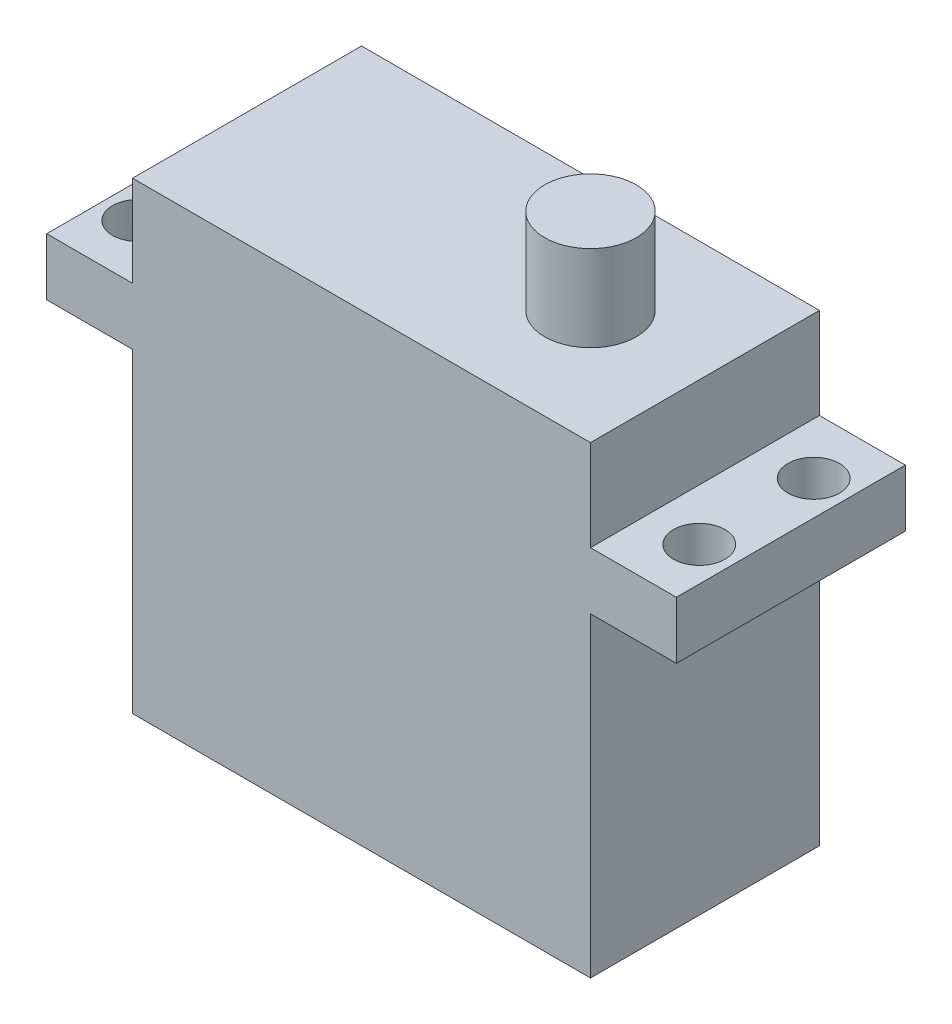
from build123d import *

# Parameters (mm, degrees)
SKETCH1_W           = 40
SKETCH1_H           = 20
BOSS_EXTRUDE1_DEPTH = 40.5
SKETCH2_W           = 20
SKETCH2_H           = 5
BOSS_EXTRUDE2_DEPTH = 7.5
SKETCH3_R           = 2.25
CUT_EXTRUDE1_DEPTH  = 50.964987741
SKETCH4_R           = 4
BOSS_EXTRUDE3_DEPTH = 7.5


with BuildPart() as part:
    # Sketch1 → Boss-Extrude1 (new body)
    with BuildSketch(Plane(origin=(0, 0, 0), x_dir=(1, 0, 0), z_dir=(0, 1, 0))):
        Rectangle(SKETCH1_W, SKETCH1_H)
    extrude(amount=BOSS_EXTRUDE1_DEPTH)

    # Sketch2 → Boss-Extrude2 (add)
    with BuildSketch(Plane(origin=(20, 0, 0), x_dir=(0, 0, -1), z_dir=(1, 0, 0))):
        with Locations((0, 30.05)):
            Rectangle(SKETCH2_W, SKETCH2_H)
    boss_extrude2 = extrude(amount=BOSS_EXTRUDE2_DEPTH)

    # Mirror1: Boss-Extrude2 across plane
    add(boss_extrude2.mirror(Plane(origin=(0, 0, 0), x_dir=(0, 0, 1), z_dir=(1, 0, 0))))

    # Sketch3 → Cut-Extrude1 (cut, through all)
    with BuildSketch(Plane(origin=(0, 0, 0), x_dir=(1, 0, 0), z_dir=(0, 1, 0))):
        with Locations(Location((-24.5, 5, 0), (0, 0, 90))):
            Circle(SKETCH3_R)
        with Locations(Location((24.5, 5, 0), (0, 0, 90))):
            Circle(SKETCH3_R)
        with Locations(Location((24.5, -5, 0), (0, 0, 90))):
            Circle(SKETCH3_R)
        with Locations(Location((-24.5, -5, 0), (0, 0, 90))):
            Circle(SKETCH3_R)
    extrude(amount=CUT_EXTRUDE1_DEPTH, mode=Mode.SUBTRACT)

    # Sketch4 → Boss-Extrude3 (add)
    with BuildSketch(Plane(origin=(0, 40.5, 0), x_dir=(1, 0, 0), z_dir=(0, 1, 0))):
        with Locations(Location((10, 0, 0), (0, 0, 270))):
            Circle(SKETCH4_R)
    extrude(amount=BOSS_EXTRUDE3_DEPTH)


solid = part.part
